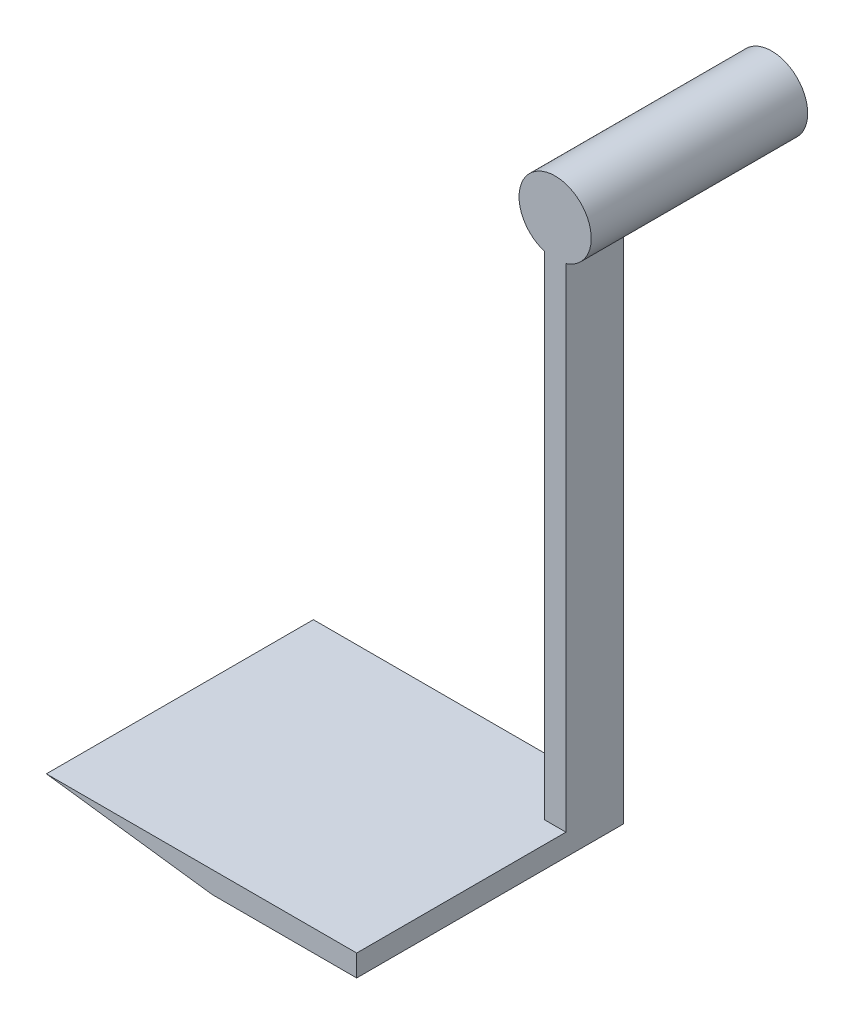
from build123d import *
from build123d.topology import SkipClean

# Parameters (mm, degrees)
EXTRUDE_1_DEPTH     = 37
SKETCH_8_W          = 29
SKETCH_8_H          = 78
CUT_EXTRUDE_3_DEPTH = 10
EXTRUDE_START       = 22
SKETCH_10_R         = 5
EXTRUDE_4_DEPTH     = 22
SKETCH_11_R         = 2.5
CUT_EXTRUDE_4_DEPTH = 20


with BuildPart() as part:
    # 草图1 → 凸台-拉伸1 (new body)
    with BuildSketch(Plane.XY):
        with BuildLine():
            Line((-19.714285714, -1.778812154), (-56.964285714, -1.778812154))
            Line((-56.964285714, -1.778812154), (-33.964285714, -4.778812154))
            Line((-33.964285714, -4.778812154), (-13.964285714, -4.778812154))
            Line((-13.964285714, -4.778812154), (-13.964285714, 66.451491839))
            ThreePointArc((-13.964285714, 66.451491839), (-15.464285714, 76.221187846), (-16.964285714, 66.451491839))
            Line((-16.964285714, 66.451491839), (-16.964285714, -1.778812154))
            Line((-16.964285714, -1.778812154), (-19.714285714, -1.778812154))
        make_face()
    extrude(amount=EXTRUDE_1_DEPTH)

    # 草图8 → 切除-拉伸3 (cut, symmetric)
    with BuildSketch(Plane(origin=(-13.964285714, 0, 0), x_dir=(0, 0, -1), z_dir=(1, 0, 0))):
        with Locations((-22.5, 37.221187846)):
            Rectangle(SKETCH_8_W, SKETCH_8_H)
    extrude(amount=CUT_EXTRUDE_3_DEPTH, both=True, mode=Mode.SUBTRACT)

    # 草图10 → 凸台-拉伸4 (add)
    with SkipClean():  # the faces are left unmerged after this step: merging them gives an invalid solid
        with BuildSketch(Plane(origin=(0, 0, 0), x_dir=(-1, 0, 0), z_dir=(0, 0, -1)).offset(EXTRUDE_START)):
            with Locations((15.464285714, 71.221187846)):
                Circle(SKETCH_10_R)
        extrude(amount=-EXTRUDE_4_DEPTH)

    # 草图11 → 切除-拉伸4 (cut)
    with SkipClean():  # the faces are left unmerged after this step: merging them gives an invalid solid
        with BuildSketch(Plane(origin=(0, 0, -22), x_dir=(-1, 0, 0), z_dir=(0, 0, -1))):
            with Locations((15.464285714, 71.221187846)):
                Circle(SKETCH_11_R)
        extrude(amount=-CUT_EXTRUDE_4_DEPTH, mode=Mode.SUBTRACT)


solid = part.part
